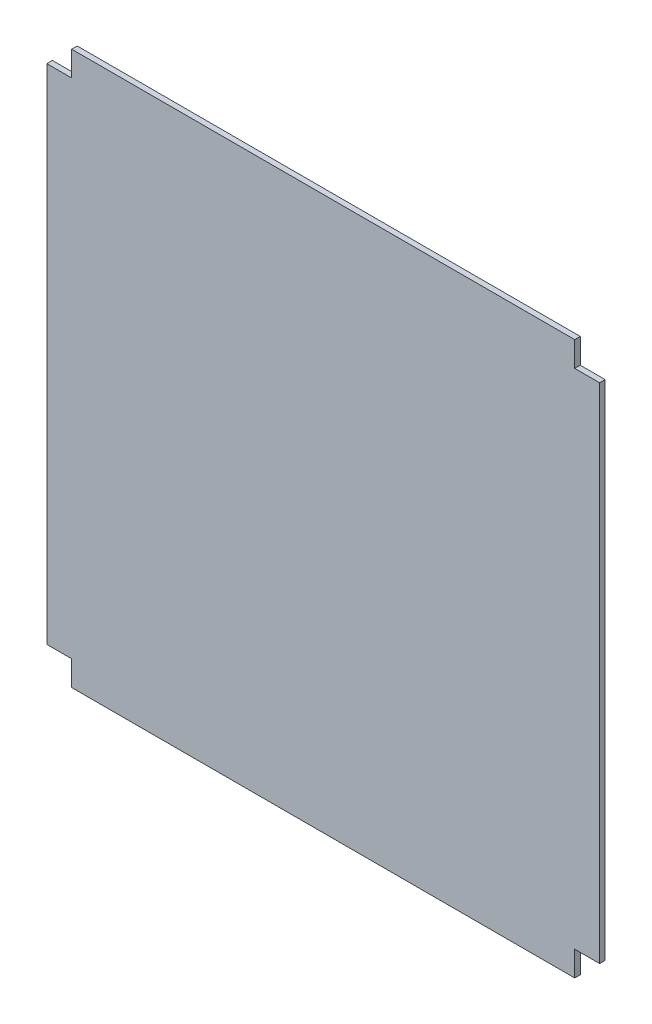
from build123d import *

# Parameters (mm, degrees)
BOSS_EXTRUDE1_DEPTH = 5.08


with BuildPart() as part:
    # Sketch1 → Boss-Extrude1 (new body)
    with BuildSketch(Plane.XY):
        Polygon((339.840781698, -290.719491675), (339.840781698, -267.859491675), (362.700781698, -267.859491675), (362.700781698, 193.404508325), (339.840781698, 193.404508325), (339.840781698, 216.264508325), (-121.423218302, 216.264508325), (-121.423218302, 193.404508325), (-144.283218302, 193.404508325), (-144.283218302, -267.859491675), (-121.423218302, -267.859491675), (-121.423218302, -290.719491675), align=None)
    extrude(amount=BOSS_EXTRUDE1_DEPTH)


solid = part.part
